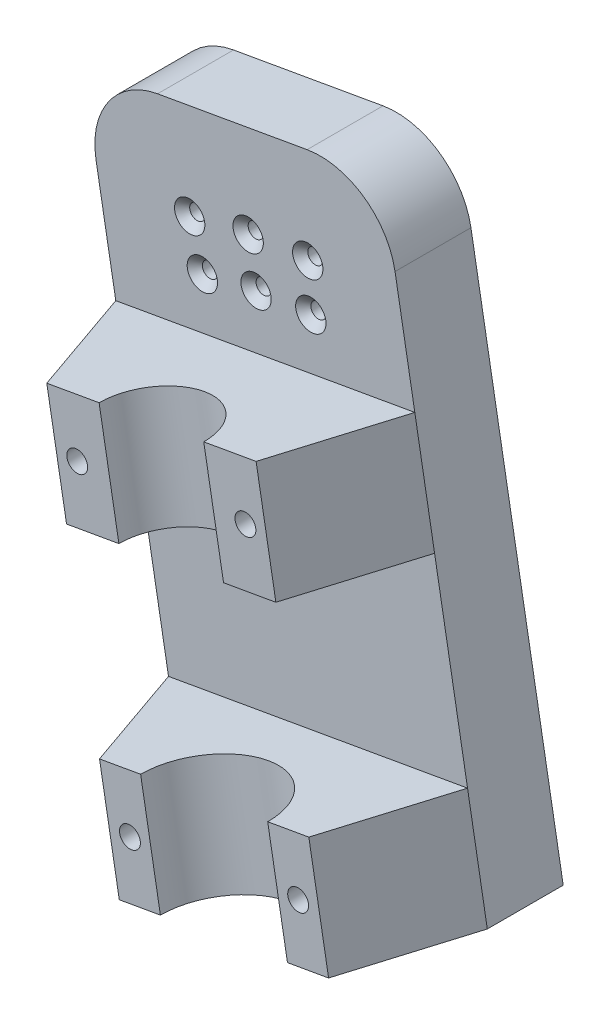
from build123d import *

# Parameters (mm, degrees)
BOSS_EXTRUDE7_DEPTH     = 10
SKETCH1_9_R             = 1
CUT_EXTRUDE4_DEPTH      = 19
CHAMFER1_SIZE           = 1
BOSS_EXTRUDE8_DEPTH     = 30
CUT_EXTRUDE7_DEPTH      = 42
CUT_EXTRUDE7_DEPTH_BACK = 39
CUT_EXTRUDE8_DEPTH      = 24
CUT_EXTRUDE9_DEPTH      = 24
SKETCH10_R              = 1.375
CUT_EXTRUDE10_DEPTH     = 7
FILLET1_R               = 10


with BuildPart() as part:
    # Sketch1 → Boss-Extrude7 (new body)
    with BuildSketch(Plane.XY):
        Polygon((-34.62989834, 81.220503206), (4.762411781, 88.166430312), (18.654265994, 9.381810071), (-20.738044126, 2.435882965), align=None)
    extrude(amount=BOSS_EXTRUDE7_DEPTH)

    # Sketch1<9> → Cut-Extrude4 (cut)
    with BuildSketch(Plane.XY):
        with Locations((-20.553187739, 71.088441211)):
            Circle(SKETCH1_9_R)
        with Locations((-5, 73.830887845)):
            Circle(SKETCH1_9_R)
        with Locations((-18.886713057, 65.324513545)):
            Circle(SKETCH1_9_R)
        with Locations((-4.594594595, 67.844599641)):
            Circle(SKETCH1_9_R)
        with Locations((-12.849965147, 72.875773723)):
            Circle(SKETCH1_9_R)
        with Locations((-11.808076081, 66.966927205)):
            Circle(SKETCH1_9_R)
    extrude(amount=CUT_EXTRUDE4_DEPTH, mode=Mode.SUBTRACT)

    # Chamfer1
    chamfer1_edges = [part.edges().sort_by_distance(p)[0] for p in [
        (-19.886713057, 65.324513545, 10),
        (-5.594594595, 67.844599641, 10),
        (-6, 73.830887845, 10),
        (-21.553187739, 71.088441211, 10),
        (-12.808076081, 66.966927205, 10),
        (-13.849965147, 72.875773723, 10),
    ]]
    chamfer(chamfer1_edges, length=CHAMFER1_SIZE)

    # Sketch6 → Boss-Extrude8 (add)
    with BuildSketch(Plane.XY.offset(10)):
        Polygon((16.049543329, 24.153926367), (-23.342766791, 17.20799926), (-20.738044126, 2.435882965), (18.654265994, 9.381810071), align=None)
        Polygon((-30.288693898, 56.60030938), (-27.683971233, 41.828193085), (11.708338888, 48.774120192), (9.103616223, 63.546236487), align=None)
    extrude(amount=BOSS_EXTRUDE8_DEPTH)

    # Sketch8 → Cut-Extrude7 (cut, two sides: drawn at the far end of the back side and taken through both)
    with BuildSketch(Plane(origin=(-3.646611731, 20.680962813, 0), x_dir=(0.984807753012227, 0.1736481776668232, 0), z_dir=(-0.1736481776668232, 0.984807753012227, 0)).offset(-CUT_EXTRUDE7_DEPTH_BACK)):
        Polygon((-14, -40), (-14, -25), (-20, -10), (-20, -40), align=None)
        Polygon((20, -10), (14, -25), (14, -40), (20, -40), align=None)
    extrude(amount=CUT_EXTRUDE7_DEPTH + CUT_EXTRUDE7_DEPTH_BACK, mode=Mode.SUBTRACT)

    # Sketch8<4> → Cut-Extrude8 (cut)
    with BuildSketch(Plane(origin=(-3.646611731, 20.680962813, 0), x_dir=(0.984807753012227, 0.1736481776668232, 0), z_dir=(-0.1736481776668232, 0.984807753012227, 0))):
        with BuildLine():
            Line((14, -25), (8.5, -25))
            ThreePointArc((8.5, -25), (0, -16.5), (-8.5, -25))
            Line((-8.5, -25), (-14, -25))
            Line((-14, -25), (-14, -40))
            Line((-14, -40), (14, -40))
            Line((14, -40), (14, -25))
        make_face()
    extrude(amount=-CUT_EXTRUDE8_DEPTH, mode=Mode.SUBTRACT)

    # Sketch7 → Cut-Extrude9 (cut)
    with BuildSketch(Plane(origin=(-10.592538838, 60.073272934, 0), x_dir=(0.984807753012227, 0.17364817766682317, 0), z_dir=(-0.17364817766682317, 0.984807753012227, 0))):
        with BuildLine():
            Line((20, -40), (20, -10))
            Line((20, -10), (14, -25))
            Line((14, -25), (7, -25))
            ThreePointArc((7, -25), (0, -18), (-7, -25))
            Line((-7, -25), (-14, -25))
            Line((-14, -25), (-20, -10))
            Line((-20, -10), (-20, -40))
            Line((-20, -40), (20, -40))
        make_face()
    extrude(amount=-CUT_EXTRUDE9_DEPTH, mode=Mode.SUBTRACT)

    # Sketch10 → Cut-Extrude10 (cut)
    with BuildSketch(Plane.XY.offset(25)):
        with Locations((-13.42333762, 11.341362667)):
            Circle(SKETCH10_R)
        with Locations((8.734836823, 15.248446664)):
            Circle(SKETCH10_R)
        with Locations((-20.369264727, 50.733672787)):
            Circle(SKETCH10_R)
        with Locations((1.788909716, 54.640756785)):
            Circle(SKETCH10_R)
    extrude(amount=-CUT_EXTRUDE10_DEPTH, mode=Mode.SUBTRACT)

    # Fillet1
    fillet1_edges = [part.edges().sort_by_distance(p)[0] for p in [
        (4.762411781, 88.166430312, 5),
        (-34.62989834, 81.220503206, 5),
    ]]
    fillet(fillet1_edges, radius=FILLET1_R)


solid = part.part
